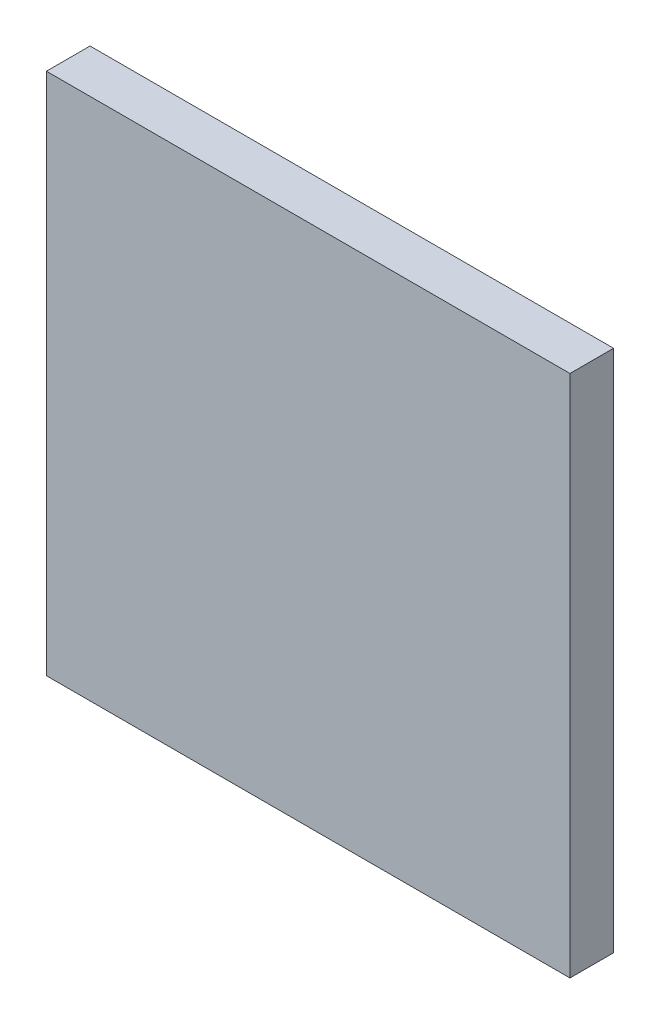
from build123d import *

# Parameters (mm, degrees)
SKETCH1_W           = 120000
SKETCH1_H           = 120000
BOSS_EXTRUDE1_DEPTH = 10000


with BuildPart() as part:
    # Sketch1 → Boss-Extrude1 (new body)
    with BuildSketch(Plane.XY):
        with Locations((60000, 60000)):
            Rectangle(SKETCH1_W, SKETCH1_H)
    extrude(amount=BOSS_EXTRUDE1_DEPTH)


solid = part.part
